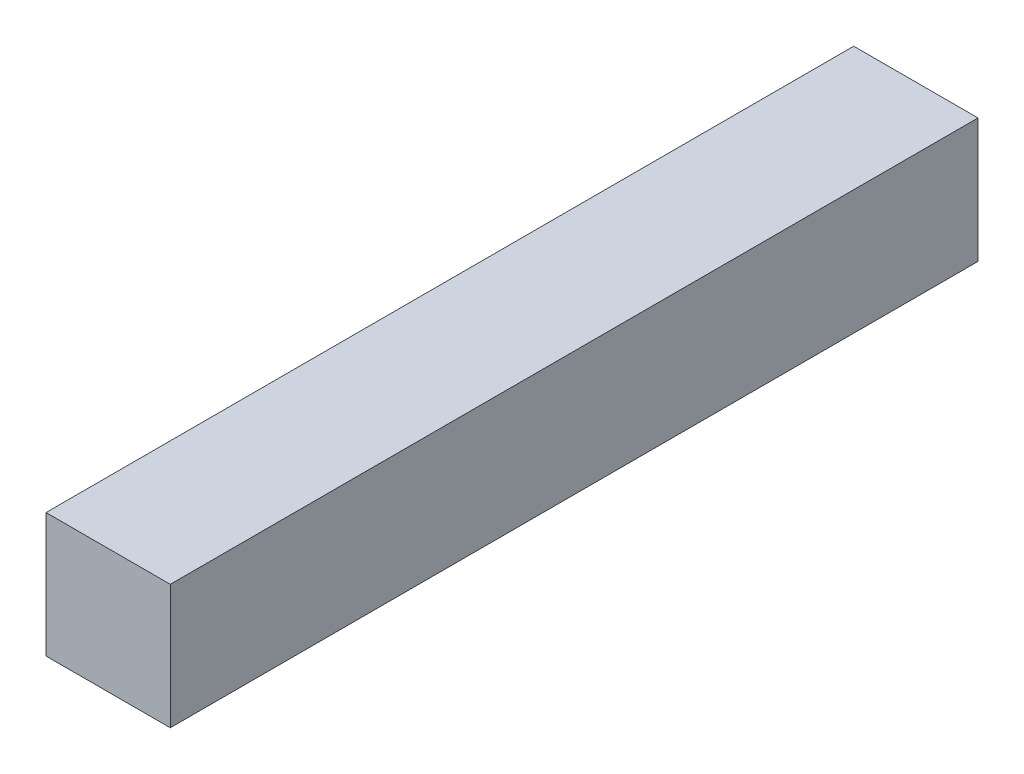
from build123d import *

# Parameters (mm, degrees)
SKETCH1_W           = 25.4
SKETCH1_H           = 25.4
BOSS_EXTRUDE1_DEPTH = 165.1


with BuildPart() as part:
    # Sketch1 → Boss-Extrude1 (new body)
    with BuildSketch(Plane.XY):
        Rectangle(SKETCH1_W, SKETCH1_H)
    extrude(amount=BOSS_EXTRUDE1_DEPTH)


solid = part.part
